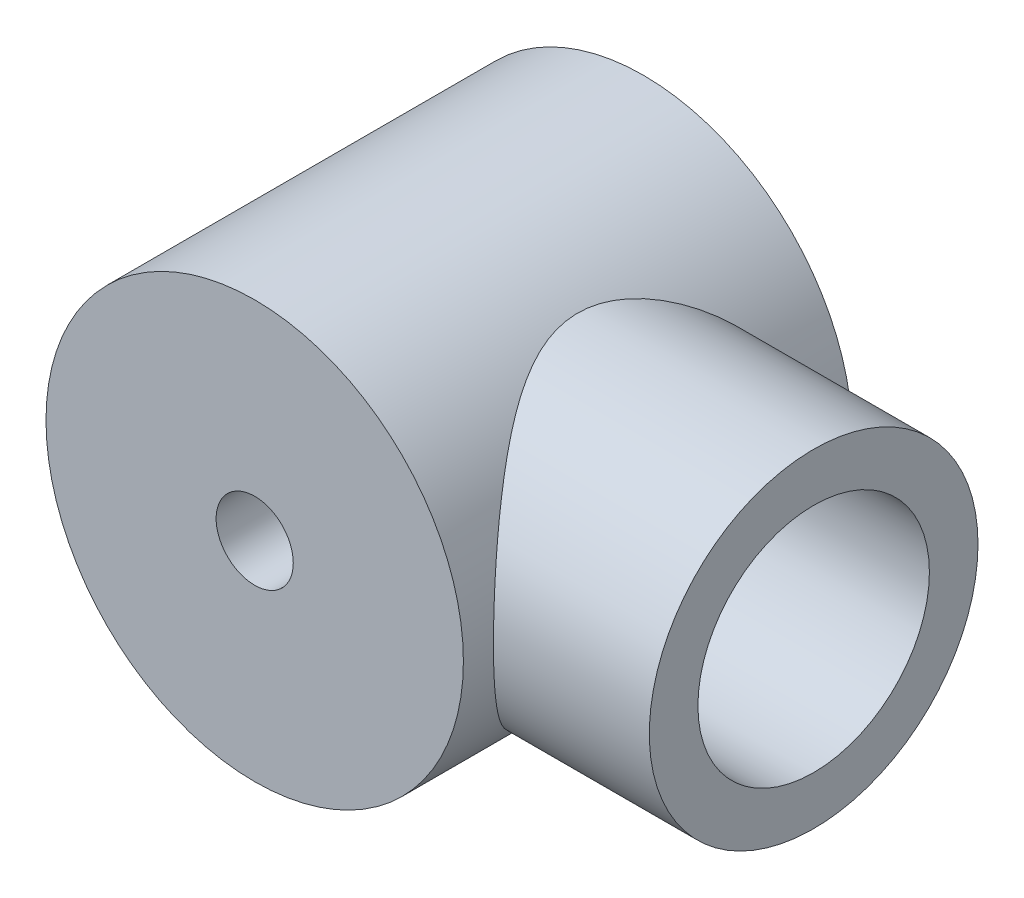
from build123d import *

# Parameters (mm, degrees)
BOSS_EXTRUDE2_DEPTH      = 8
BOSS_EXTRUDE2_DEPTH_BACK = 8
SKETCH1_R                = 8.5875
SKETCH1_R_2              = 1.5875
SKETCH2_R                = 6.7625
SKETCH2_R_2              = 4.7625
BOSS_EXTRUDE3_DEPTH      = 15
CUT_EXTRUDE1_DEPTH       = 10
CUT_EXTRUDE1_DEPTH_BACK  = 10
SKETCH3_R                = 1.5875


with BuildPart() as part:
    # Sketch1 → Boss-Extrude2 (new, two sides: drawn at the far end of the back side and taken through both)
    with BuildSketch(Plane.XY.offset(-BOSS_EXTRUDE2_DEPTH_BACK)):
        Circle(SKETCH1_R)
        Circle(SKETCH1_R_2, mode=Mode.SUBTRACT)
    extrude(amount=BOSS_EXTRUDE2_DEPTH + BOSS_EXTRUDE2_DEPTH_BACK)

    # Sketch2 → Boss-Extrude3 (add)
    with BuildSketch(Plane(origin=(0, 0, 0), x_dir=(0, 0, -1), z_dir=(1, 0, 0))):
        Circle(SKETCH2_R)
        Circle(SKETCH2_R_2, mode=Mode.SUBTRACT)
    extrude(amount=BOSS_EXTRUDE3_DEPTH)

    # Sketch3 → Cut-Extrude1 (cut, two sides: drawn at the far end of the back side and taken through both)
    with BuildSketch(Plane.XY.offset(-CUT_EXTRUDE1_DEPTH_BACK)):
        Circle(SKETCH3_R)
    extrude(amount=CUT_EXTRUDE1_DEPTH + CUT_EXTRUDE1_DEPTH_BACK, mode=Mode.SUBTRACT)


solid = part.part
